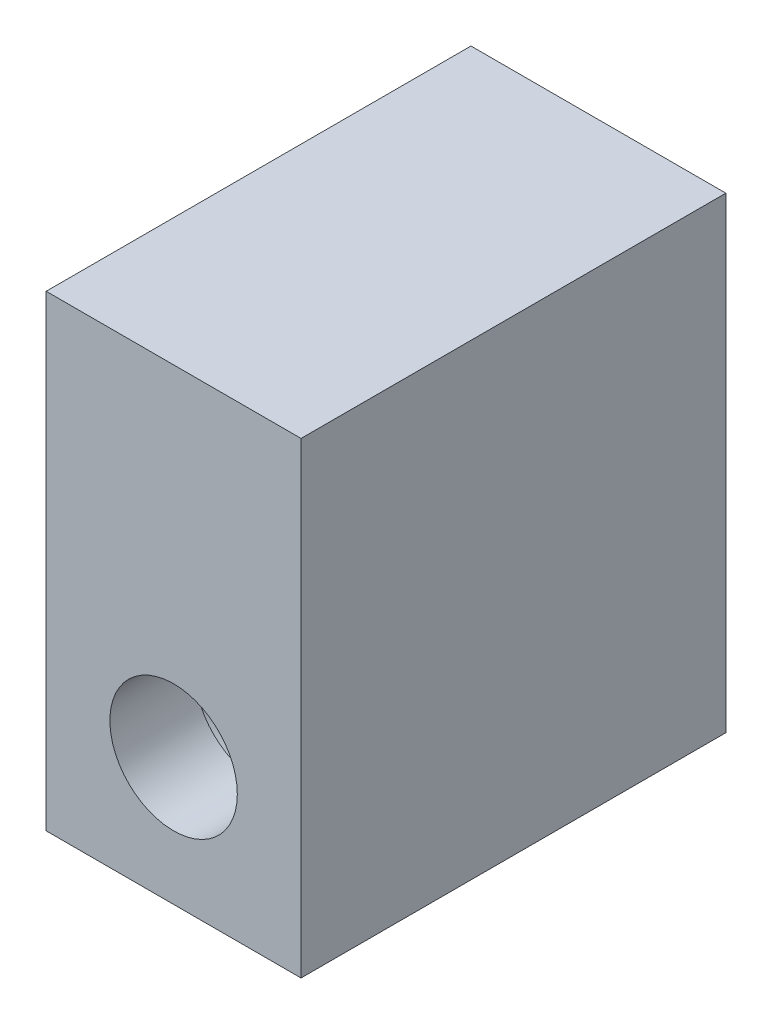
from build123d import *

# Parameters (mm, degrees)
SKETCH1_W           = 50
SKETCH1_H           = 70
BOSS_EXTRUDE1_DEPTH = 10
SKETCH2_R           = 7.5
CUT_EXTRUDE1_DEPTH  = 10
SKETCH3_W           = 50
SKETCH3_H           = 70
BOSS_EXTRUDE2_DEPTH = 40
SKETCH4_R           = 10.5
CUT_EXTRUDE3_DEPTH  = 40
SKETCH5_W           = 10
SKETCH5_H           = 70
CUT_EXTRUDE4_DEPTH  = 50
SKETCH6_R           = 6
CUT_EXTRUDE5_DEPTH  = 20
SKETCH7_W           = 50
SKETCH7_H           = 15
CUT_EXTRUDE6_DEPTH  = 30


with BuildPart() as part:
    # Sketch1 → Boss-Extrude1 (new body)
    with BuildSketch(Plane.XY):
        with Locations((-25, 35)):
            Rectangle(SKETCH1_W, SKETCH1_H)
    extrude(amount=BOSS_EXTRUDE1_DEPTH)

    # Sketch2 → Cut-Extrude1 (cut)
    with BuildSketch(Plane.XY.offset(10)):
        with Locations((-25, 15)):
            Circle(SKETCH2_R)
    extrude(amount=-CUT_EXTRUDE1_DEPTH, mode=Mode.SUBTRACT)

    # Sketch3 → Boss-Extrude2 (add)
    with BuildSketch(Plane(origin=(0, 0, 0), x_dir=(-1, 0, 0), z_dir=(0, 0, -1))):
        with Locations((25, 35)):
            Rectangle(SKETCH3_W, SKETCH3_H)
    extrude(amount=BOSS_EXTRUDE2_DEPTH)

    # Sketch4 → Cut-Extrude3 (cut)
    with BuildSketch(Plane(origin=(0, 0, -40), x_dir=(-1, 0, 0), z_dir=(0, 0, -1))):
        with Locations((25, 15)):
            Circle(SKETCH4_R)
    extrude(amount=-CUT_EXTRUDE3_DEPTH, mode=Mode.SUBTRACT)

    # Sketch5 → Cut-Extrude4 (cut)
    with BuildSketch(Plane(origin=(0, 0, -40), x_dir=(-1, 0, 0), z_dir=(0, 0, -1))):
        with Locations((5, 35)):
            Rectangle(SKETCH5_W, SKETCH5_H)
        with Locations((45, 35)):
            Rectangle(SKETCH5_W, SKETCH5_H)
    extrude(amount=-CUT_EXTRUDE4_DEPTH, mode=Mode.SUBTRACT)

    # Sketch6 → Cut-Extrude5 (cut)
    with BuildSketch(Plane.ZY.offset(40)):
        with Locations(Location((-27.5, 40, 0), (0, 0, 270))):
            Circle(SKETCH6_R)
        with Locations(Location((-2.5, 40, 0), (0, 0, 270))):
            Circle(SKETCH6_R)
    extrude(amount=-CUT_EXTRUDE5_DEPTH, mode=Mode.SUBTRACT)

    # Sketch7 → Cut-Extrude6 (cut)
    with BuildSketch(Plane.ZY.offset(40)):
        with Locations((-15, 62.5)):
            Rectangle(SKETCH7_W, SKETCH7_H)
    extrude(amount=-CUT_EXTRUDE6_DEPTH, mode=Mode.SUBTRACT)


solid = part.part
